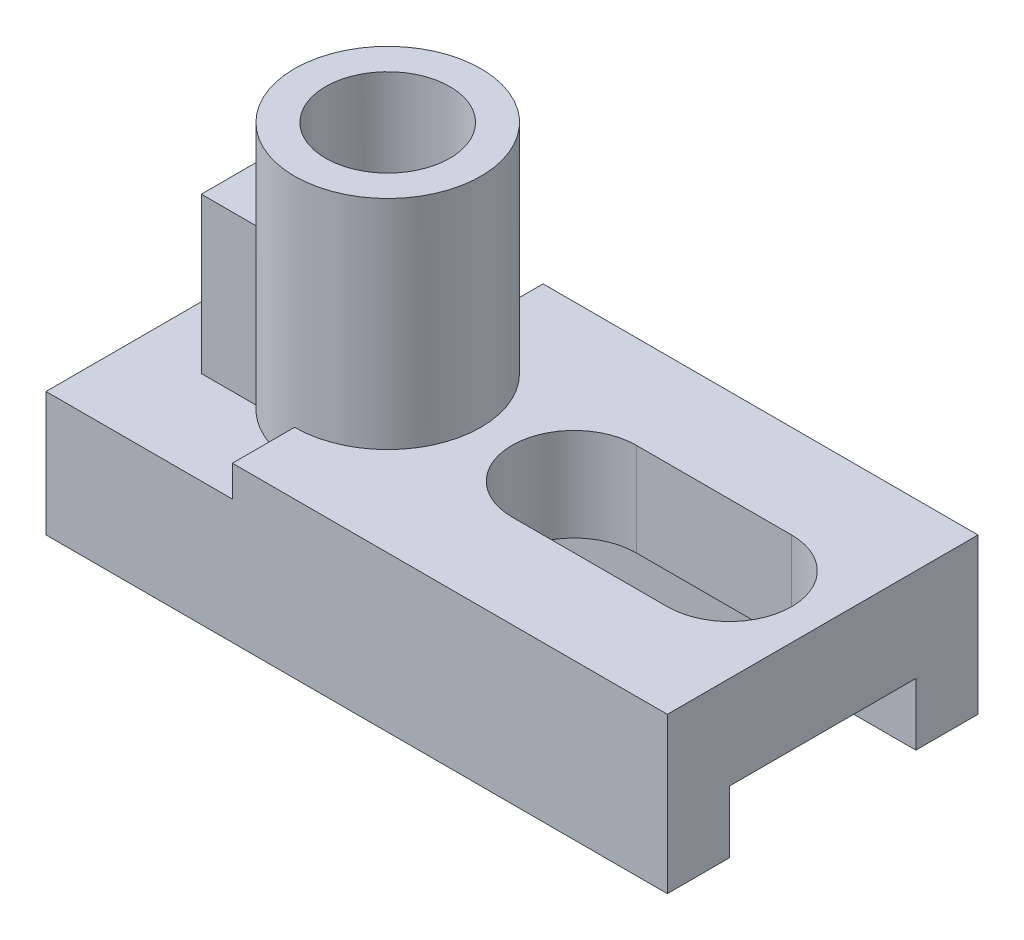
from build123d import *

# Parameters (mm, degrees)
BOSS_EXTRUDE1_DEPTH             = 25
SKETCH2_W                       = 30
SKETCH2_H                       = 10
CUT_EXTRUDE1_DEPTH              = 107.066017178
BOSS_EXTRUDE2_REACH             = 108.066
SKETCH3_R                       = 15
SKETCH3_R_2                     = 10
BOSS_EXTRUDE2_DIRECTION_2_DEPTH = 35
CUT_EXTRUDE2_DEPTH              = 109.857705285
BOSS_EXTRUDE3_REACH             = 113.018
BOSS_EXTRUDE3_END_RADIUS        = 15
SKETCH4_W                       = 20
SKETCH4_H                       = 25
CUT_EXTRUDE3_REACH              = 113.018
CUT_EXTRUDE3_END_RADIUS         = 10
SKETCH5_R                       = 5
CUT_EXTRUDE4_REACH              = 110.858


with BuildPart() as part:
    # Sketch1 → Boss-Extrude1 (new, symmetric)
    with BuildSketch(Plane.XY):
        Polygon((0, 0), (100, 0), (100, 25), (30, 25), (30, 20), (0, 20), align=None)
    extrude(amount=BOSS_EXTRUDE1_DEPTH, both=True)

    # Sketch2 → Cut-Extrude1 (cut, through all)
    with BuildSketch(Plane.ZY):
        with Locations((0, 5)):
            Rectangle(SKETCH2_W, SKETCH2_H)
    extrude(amount=-CUT_EXTRUDE1_DEPTH, mode=Mode.SUBTRACT)

    # Boss-Extrude2: up to this face of the body (flat: up to its plane)
    boss_extrude2_end = Plane(part.part.faces().sort_by_distance((15, 20, 0))[0])
    # Sketch3 → Boss-Extrude2 (add, up to the picked face)
    with BuildSketch(Plane(origin=(0, 25, 0), x_dir=(1, 0, 0), z_dir=(0, 1, 0)), mode=Mode.PRIVATE) as boss_extrude2_sk1:
        with Locations(Location((30, 0, 0), (0, 0, 270))):
            Circle(SKETCH3_R)
        with Locations(Location((30, 0, 0), (0, 0, 90))):
            Circle(SKETCH3_R_2, mode=Mode.SUBTRACT)
    boss_extrude2_tool1 = split(extrude(boss_extrude2_sk1.sketch, amount=-BOSS_EXTRUDE2_REACH, mode=Mode.PRIVATE), bisect_by=boss_extrude2_end, keep=Keep.BOTH, mode=Mode.PRIVATE)
    add(boss_extrude2_tool1.solids().sort_by(Axis((30, 25, -14.575736), (0, -1, 0)))[0])

    # Sketch3 → Boss-Extrude2 direction 2 (add)
    with BuildSketch(Plane(origin=(0, 25, 0), x_dir=(1, 0, 0), z_dir=(0, 1, 0))):
        with Locations(Location((30, 0, 0), (0, 0, 270))):
            Circle(SKETCH3_R)
        with Locations(Location((30, 0, 0), (0, 0, 90))):
            Circle(SKETCH3_R_2, mode=Mode.SUBTRACT)
    extrude(amount=BOSS_EXTRUDE2_DIRECTION_2_DEPTH)

    # Sketch3<2> → Cut-Extrude2 (cut, through all)
    with BuildSketch(Plane(origin=(0, 25, 0), x_dir=(1, 0, 0), z_dir=(0, 1, 0))):
        with BuildLine():
            Line((30, -10), (30, 10))
            ThreePointArc((30, 10), (20, 0), (30, -10))
        make_face()
        with BuildLine():
            ThreePointArc((40, 0), (37.071067812, 7.071067812), (30, 10))
            Line((30, 10), (30, -10))
            ThreePointArc((30, -10), (37.071067812, -7.071067812), (40, 0))
        make_face()
    extrude(amount=-CUT_EXTRUDE2_DEPTH, mode=Mode.SUBTRACT)

    # Boss-Extrude3: up to this cylinder (the profile starts outside it)
    boss_extrude3_end = Plane(origin=(30, 32.5, 0), z_dir=(0, -1, 0)) * Cylinder(BOSS_EXTRUDE3_END_RADIUS, 257.036, mode=Mode.PRIVATE)
    # Sketch4 → Boss-Extrude3 (add, up to the surface)
    with BuildSketch(Plane.ZY.offset(-10), mode=Mode.PRIVATE) as boss_extrude3_sk1:
        with Locations((0, 32.5)):
            Rectangle(SKETCH4_W, SKETCH4_H)
    boss_extrude3_tool1 = extrude(boss_extrude3_sk1.sketch, amount=-BOSS_EXTRUDE3_REACH, mode=Mode.PRIVATE) - boss_extrude3_end
    add(boss_extrude3_tool1.solids().sort_by_distance((10, 32.5, 0))[0])

    # Cut-Extrude3: up to this cylinder (the profile starts outside it)
    cut_extrude3_end = Plane(origin=(30, 32.5, 0), z_dir=(0, -1, 0)) * Cylinder(CUT_EXTRUDE3_END_RADIUS, 247.036, mode=Mode.PRIVATE)
    # Sketch5 → Cut-Extrude3 (cut, up to the surface)
    with BuildSketch(Plane.ZY.offset(-10), mode=Mode.PRIVATE) as cut_extrude3_sk1:
        with Locations((0, 32.5)):
            Circle(SKETCH5_R)
    cut_extrude3_tool1 = extrude(cut_extrude3_sk1.sketch, amount=-CUT_EXTRUDE3_REACH, mode=Mode.PRIVATE) - cut_extrude3_end
    add(cut_extrude3_tool1.solids().sort_by_distance((10, 32.5, 0))[0], mode=Mode.SUBTRACT)

    # Sketch6 → Cut-Extrude4 (cut, up to next)
    with BuildSketch(Plane(origin=(0, 25, 0), x_dir=(1, 0, 0), z_dir=(0, 1, 0)), mode=Mode.PRIVATE) as cut_extrude4_sk1:
        with BuildLine():
            Line((60, 10), (85, 10))
            ThreePointArc((85, 10), (95, 0), (85, -10))
            Line((85, -10), (60, -10))
            ThreePointArc((60, -10), (50, 0), (60, 10))
        make_face()
    cut_extrude4_tool1 = extrude(cut_extrude4_sk1.sketch, amount=-CUT_EXTRUDE4_REACH, mode=Mode.PRIVATE) & part.part
    add(cut_extrude4_tool1.solids().sort_by_distance((72.5, 25, 0))[0], mode=Mode.SUBTRACT)


solid = part.part
